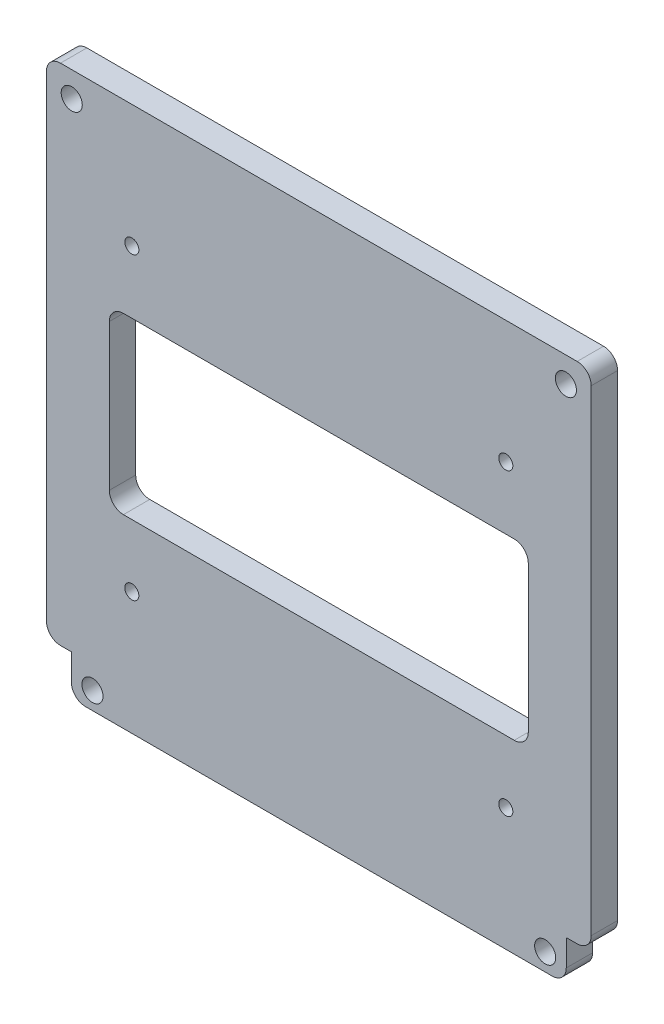
from build123d import *

# Parameters (mm, degrees)
SKETCH1_W           = 98.425
SKETCH1_H           = 98.425
BOSS_EXTRUDE1_DEPTH = 4.7625
CUT_EXTRUDE1_REACH  = 119.54
SKETCH4_R           = 1.27
SKETCH4_R_2         = 1.905
SKETCH4_W           = 75.692
SKETCH4_H           = 31.496
CUT_EXTRUDE2_REACH  = 119.54
SKETCH5_W           = 4.5085
SKETCH5_H           = 7.3025
FILLET1_R           = 2.54
FILLET3_R           = 2.54
FILLET4_R           = 2.54


with BuildPart() as part:
    # Sketch1 → Boss-Extrude1 (new body)
    with BuildSketch(Plane.XY):
        with Locations((-38.559564005, 28.819230769)):
            Rectangle(SKETCH1_W, SKETCH1_H)
    extrude(amount=BOSS_EXTRUDE1_DEPTH)

    # Sketch4 → Cut-Extrude1 (cut, up to next)
    with BuildSketch(Plane(origin=(0, 0, 0), x_dir=(-1, 0, 0), z_dir=(0, 0, -1)), mode=Mode.PRIVATE) as cut_extrude1_sk1:
        with Locations(Location((72.341564005, 55.870230769, 0), (0, 0, 180))):
            Circle(SKETCH4_R)
    cut_extrude1_tool1 = extrude(cut_extrude1_sk1.sketch, amount=-CUT_EXTRUDE1_REACH, mode=Mode.PRIVATE) & part.part
    # Sketch4 → Cut-Extrude1 (cut, up to next)
    with BuildSketch(Plane(origin=(0, 0, 0), x_dir=(-1, 0, 0), z_dir=(0, 0, -1)), mode=Mode.PRIVATE) as cut_extrude1_sk2:
        with Locations((72.341564005, 1.768230769)):
            Circle(SKETCH4_R)
    cut_extrude1_tool2 = extrude(cut_extrude1_sk2.sketch, amount=-CUT_EXTRUDE1_REACH, mode=Mode.PRIVATE) & part.part
    # Sketch4 → Cut-Extrude1 (cut, up to next)
    with BuildSketch(Plane(origin=(0, 0, 0), x_dir=(-1, 0, 0), z_dir=(0, 0, -1)), mode=Mode.PRIVATE) as cut_extrude1_sk3:
        with Locations((4.777564005, 55.870230769)):
            Circle(SKETCH4_R)
    cut_extrude1_tool3 = extrude(cut_extrude1_sk3.sketch, amount=-CUT_EXTRUDE1_REACH, mode=Mode.PRIVATE) & part.part
    # Sketch4 → Cut-Extrude1 (cut, up to next)
    with BuildSketch(Plane(origin=(0, 0, 0), x_dir=(-1, 0, 0), z_dir=(0, 0, -1)), mode=Mode.PRIVATE) as cut_extrude1_sk4:
        with Locations(Location((4.777564005, 1.768230769, 0), (0, 0, 180))):
            Circle(SKETCH4_R)
    cut_extrude1_tool4 = extrude(cut_extrude1_sk4.sketch, amount=-CUT_EXTRUDE1_REACH, mode=Mode.PRIVATE) & part.part
    # Sketch4 → Cut-Extrude1 (cut, up to next)
    with BuildSketch(Plane(origin=(0, 0, 0), x_dir=(-1, 0, 0), z_dir=(0, 0, -1)), mode=Mode.PRIVATE) as cut_extrude1_sk5:
        with Locations((-6.080935995, 73.459730769)):
            Circle(SKETCH4_R_2)
    cut_extrude1_tool5 = extrude(cut_extrude1_sk5.sketch, amount=-CUT_EXTRUDE1_REACH, mode=Mode.PRIVATE) & part.part
    # Sketch4 → Cut-Extrude1 (cut, up to next)
    with BuildSketch(Plane(origin=(0, 0, 0), x_dir=(-1, 0, 0), z_dir=(0, 0, -1)), mode=Mode.PRIVATE) as cut_extrude1_sk6:
        with Locations(Location((83.200064005, 73.459730769, 0), (0, 0, 180))):
            Circle(SKETCH4_R_2)
    cut_extrude1_tool6 = extrude(cut_extrude1_sk6.sketch, amount=-CUT_EXTRUDE1_REACH, mode=Mode.PRIVATE) & part.part
    # Sketch4 → Cut-Extrude1 (cut, up to next)
    with BuildSketch(Plane(origin=(0, 0, 0), x_dir=(-1, 0, 0), z_dir=(0, 0, -1)), mode=Mode.PRIVATE) as cut_extrude1_sk7:
        with Locations((-2.334435995, -17.218269231)):
            Circle(SKETCH4_R_2)
    cut_extrude1_tool7 = extrude(cut_extrude1_sk7.sketch, amount=-CUT_EXTRUDE1_REACH, mode=Mode.PRIVATE) & part.part
    # Sketch4 → Cut-Extrude1 (cut, up to next)
    with BuildSketch(Plane(origin=(0, 0, 0), x_dir=(-1, 0, 0), z_dir=(0, 0, -1)), mode=Mode.PRIVATE) as cut_extrude1_sk8:
        with Locations((79.453564005, -17.218269231)):
            Circle(SKETCH4_R_2)
    cut_extrude1_tool8 = extrude(cut_extrude1_sk8.sketch, amount=-CUT_EXTRUDE1_REACH, mode=Mode.PRIVATE) & part.part
    # Sketch4 → Cut-Extrude1 (cut, up to next)
    with BuildSketch(Plane(origin=(0, 0, 0), x_dir=(-1, 0, 0), z_dir=(0, 0, -1)), mode=Mode.PRIVATE) as cut_extrude1_sk9:
        with Locations((38.559564005, 28.819230769)):
            Rectangle(SKETCH4_W, SKETCH4_H)
    cut_extrude1_tool9 = extrude(cut_extrude1_sk9.sketch, amount=-CUT_EXTRUDE1_REACH, mode=Mode.PRIVATE) & part.part
    add(cut_extrude1_tool1.solids().sort_by_distance((-72.341564, 55.870231, 0))[0], mode=Mode.SUBTRACT)
    add(cut_extrude1_tool2.solids().sort_by_distance((-72.341564, 1.768231, 0))[0], mode=Mode.SUBTRACT)
    add(cut_extrude1_tool3.solids().sort_by_distance((-4.777564, 55.870231, 0))[0], mode=Mode.SUBTRACT)
    add(cut_extrude1_tool4.solids().sort_by_distance((-4.777564, 1.768231, 0))[0], mode=Mode.SUBTRACT)
    add(cut_extrude1_tool5.solids().sort_by_distance((6.080936, 73.459731, 0))[0], mode=Mode.SUBTRACT)
    add(cut_extrude1_tool6.solids().sort_by_distance((-83.200064, 73.459731, 0))[0], mode=Mode.SUBTRACT)
    add(cut_extrude1_tool7.solids().sort_by_distance((2.334436, -17.218269, 0))[0], mode=Mode.SUBTRACT)
    add(cut_extrude1_tool8.solids().sort_by_distance((-79.453564, -17.218269, 0))[0], mode=Mode.SUBTRACT)
    add(cut_extrude1_tool9.solids().sort_by_distance((-38.559564, 28.819231, 0))[0], mode=Mode.SUBTRACT)

    # Sketch5 → Cut-Extrude2 (cut, up to next)
    with BuildSketch(Plane(origin=(0, 0, 0), x_dir=(-1, 0, 0), z_dir=(0, 0, -1)), mode=Mode.PRIVATE) as cut_extrude2_sk1:
        with Locations((-8.398685995, -16.742019231)):
            Rectangle(SKETCH5_W, SKETCH5_H)
    cut_extrude2_tool1 = extrude(cut_extrude2_sk1.sketch, amount=-CUT_EXTRUDE2_REACH, mode=Mode.PRIVATE) & part.part
    # Sketch5 → Cut-Extrude2 (cut, up to next)
    with BuildSketch(Plane(origin=(0, 0, 0), x_dir=(-1, 0, 0), z_dir=(0, 0, -1)), mode=Mode.PRIVATE) as cut_extrude2_sk2:
        with Locations((85.517814005, -16.742019231)):
            Rectangle(SKETCH5_W, SKETCH5_H)
    cut_extrude2_tool2 = extrude(cut_extrude2_sk2.sketch, amount=-CUT_EXTRUDE2_REACH, mode=Mode.PRIVATE) & part.part
    add(cut_extrude2_tool1.solids().sort_by_distance((8.398686, -16.742019, 0))[0], mode=Mode.SUBTRACT)
    add(cut_extrude2_tool2.solids().sort_by_distance((-85.517814, -16.742019, 0))[0], mode=Mode.SUBTRACT)

    # Fillet1
    fillet1_edges = [part.edges().sort_by_distance(p)[0] for p in [
        (-87.772064005, 78.031730769, 2.38125),
        (10.652935995, 78.031730769, 2.38125),
    ]]
    fillet(fillet1_edges, radius=FILLET1_R)

    # Fillet3
    fillet3_edges = [part.edges().sort_by_distance(p)[0] for p in [
        (-0.713564005, 13.071230769, 2.38125),
        (-0.713564005, 44.567230769, 2.38125),
        (-76.405564005, 44.567230769, 2.38125),
        (-76.405564005, 13.071230769, 2.38125),
    ]]
    fillet(fillet3_edges, radius=FILLET3_R)

    # Fillet4
    fillet4_edges = [part.edges().sort_by_distance(p)[0] for p in [
        (6.144435995, -20.393269231, 2.38125),
        (10.652935995, -13.090769231, 2.38125),
        (-83.263564005, -20.393269231, 2.38125),
        (-87.772064005, -13.090769231, 2.38125),
    ]]
    fillet(fillet4_edges, radius=FILLET4_R)


solid = part.part
